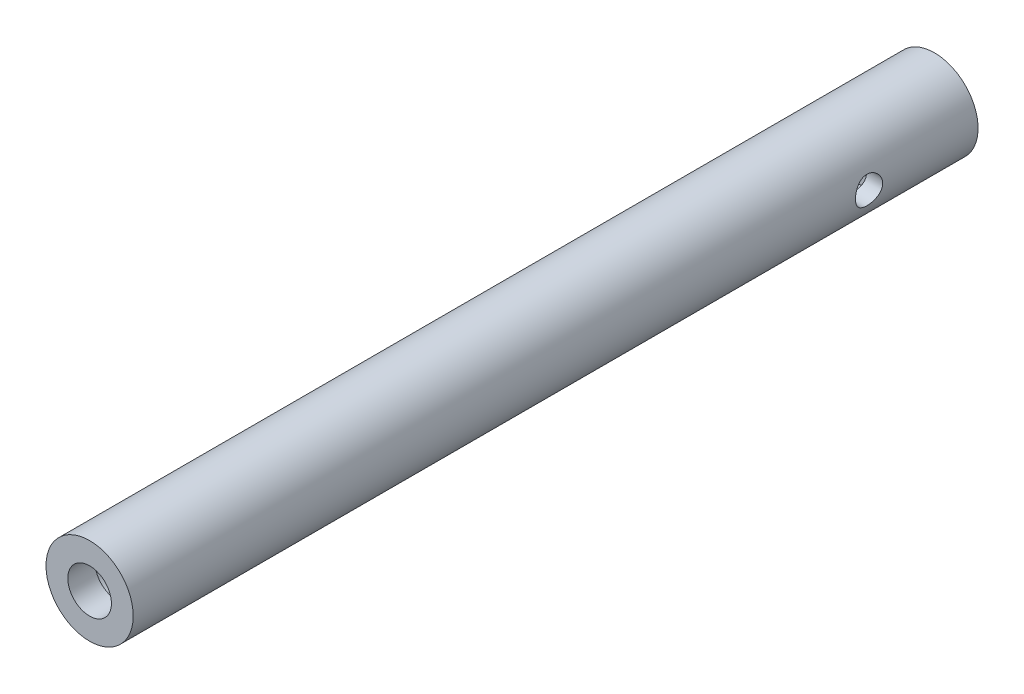
from build123d import *

# Parameters (mm, degrees)
SKETCH1_R               = 8
BOSS_EXTRUDE1_DEPTH     = 150
SKETCH2_R               = 4
CUT_EXTRUDE1_DEPTH      = 5
SKETCH3_R               = 5
CUT_EXTRUDE2_DEPTH      = 135
CUT_EXTRUDE3_DEPTH      = 151.426061572
CUT_EXTRUDE3_DEPTH_BACK = 151.426061572
SKETCH4_R               = 2.5
BOSS_EXTRUDE2_START     = 5
SKETCH5_R               = 8
BOSS_EXTRUDE2_DEPTH     = 5
CUT_EXTRUDE4_START      = -2
SKETCH6_R               = 5
CUT_EXTRUDE4_DEPTH      = 2
SKETCH7_R               = 7
CUT_EXTRUDE5_DEPTH      = 2


with BuildPart() as part:
    # Sketch1 → Boss-Extrude1 (new body)
    with BuildSketch(Plane.XY):
        Circle(SKETCH1_R)
    extrude(amount=BOSS_EXTRUDE1_DEPTH)

    # Sketch2 → Cut-Extrude1 (cut)
    with BuildSketch(Plane.XY.offset(150)):
        Circle(SKETCH2_R)
    extrude(amount=-CUT_EXTRUDE1_DEPTH, mode=Mode.SUBTRACT)

    # Sketch3 → Cut-Extrude2 (cut)
    with BuildSketch(Plane.XY.offset(145)):
        Circle(SKETCH3_R)
    extrude(amount=-CUT_EXTRUDE2_DEPTH, mode=Mode.SUBTRACT)

    # Sketch4 → Cut-Extrude3 (cut, two sides: drawn at the far end of the back side and taken through both)
    with BuildSketch(Plane(origin=(0, 0, 0), x_dir=(0, 0, -1), z_dir=(1, 0, 0)).offset(-CUT_EXTRUDE3_DEPTH_BACK)):
        with Locations((-15, 0)):
            Circle(SKETCH4_R)
    extrude(amount=CUT_EXTRUDE3_DEPTH + CUT_EXTRUDE3_DEPTH_BACK, mode=Mode.SUBTRACT)

    # Sketch5 → Boss-Extrude2 (add)
    with BuildSketch(Plane(origin=(0, 0, 0), x_dir=(-1, 0, 0), z_dir=(0, 0, -1)).offset(BOSS_EXTRUDE2_START)):
        Circle(SKETCH5_R)
    extrude(amount=-BOSS_EXTRUDE2_DEPTH)

    # Sketch6 → Cut-Extrude4 (cut)
    with BuildSketch(Plane(origin=(0, 0, -5), x_dir=(-1, 0, 0), z_dir=(0, 0, -1)).offset(CUT_EXTRUDE4_START)):
        with Locations(Location((0, 0, 0), (0, 0, 180))):
            Circle(SKETCH6_R)
    extrude(amount=CUT_EXTRUDE4_DEPTH, mode=Mode.SUBTRACT)

    # Sketch7 → Cut-Extrude5 (cut)
    with BuildSketch(Plane(origin=(0, 0, -3), x_dir=(-1, 0, 0), z_dir=(0, 0, -1))):
        Circle(SKETCH7_R)
    extrude(amount=-CUT_EXTRUDE5_DEPTH, mode=Mode.SUBTRACT)


solid = part.part
